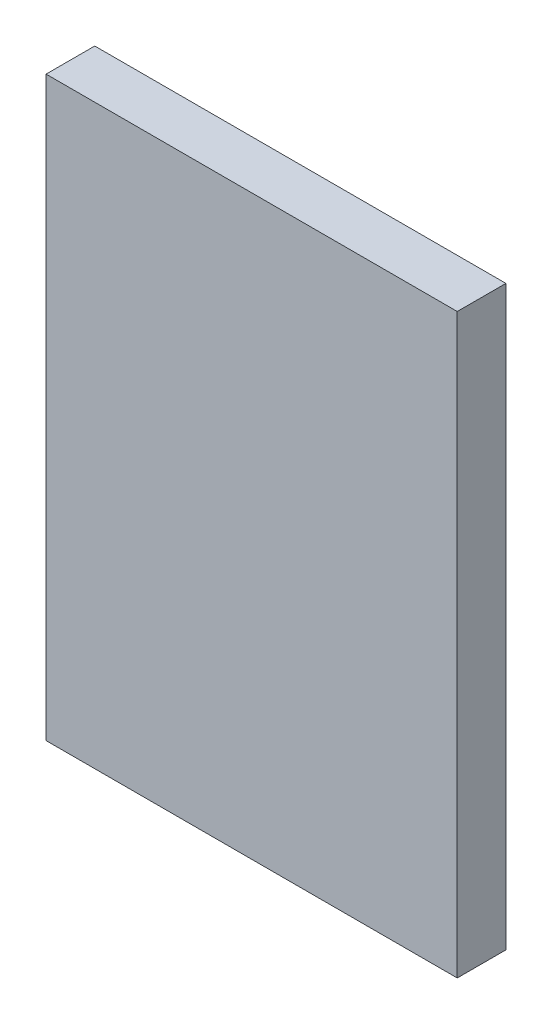
from build123d import *

# Parameters (mm, degrees)
SKETCH1_W           = 53.6448
SKETCH1_H           = 75.311
BOSS_EXTRUDE1_DEPTH = 6.35


with BuildPart() as part:
    # Sketch1 → Boss-Extrude1 (new body)
    with BuildSketch(Plane.XY):
        Rectangle(SKETCH1_W, SKETCH1_H)
    extrude(amount=BOSS_EXTRUDE1_DEPTH)


solid = part.part
